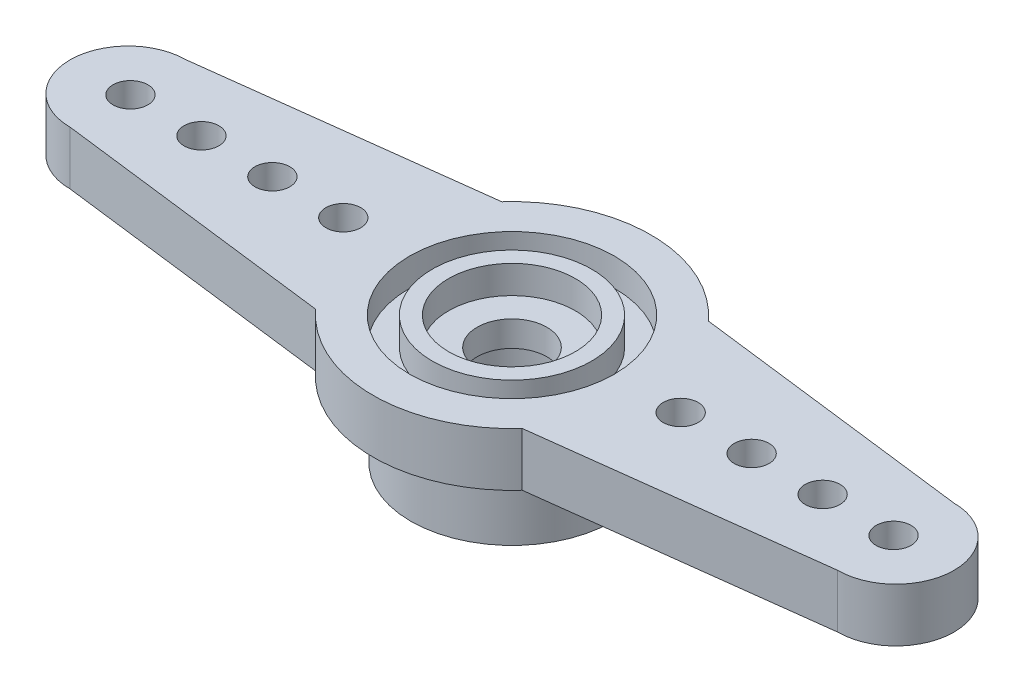
from build123d import *

# Parameters (mm, degrees)
SKETCH_1_R          = 1.5
SKETCH_1_R_2        = 0.75
EXTRUDE_1_DEPTH     = 2.3
SKETCH_2_R          = 4.35
SKETCH_2_R_2        = 2.45
EXTRUDE_2_DEPTH     = 3.2
CUT_EXTRUDE_START   = -1.2
SKETCH_3_R          = 4.4
SKETCH_3_R_2        = 3.425
SKETCH_3_R_3        = 2.725
SKETCH_3_R_4        = 1.5
CUT_EXTRUDE_1_DEPTH = 1.2


with BuildPart() as part:
    # Sketch 1 → Бобышка-Вытянуть1 (new body)
    with BuildSketch(Plane(origin=(0, 0, 0), x_dir=(1, 0, 0), z_dir=(0, 1, 0))):
        with BuildLine():
            Line((4.438538611, 4), (16.5, 2.5))
            ThreePointArc((16.5, 2.5), (19, 0), (16.5, -2.5))
            Line((16.5, -2.5), (4.438538611, -4))
            ThreePointArc((4.438538611, -4), (0, -5.975), (-4.438538611, -4))
            Line((-4.438538611, -4), (-16.5, -2.5))
            ThreePointArc((-16.5, -2.5), (-19, 0), (-16.5, 2.5))
            Line((-16.5, 2.5), (-4.438538611, 4))
            ThreePointArc((-4.438538611, 4), (0, 5.975), (4.438538611, 4))
        make_face()
        with Locations(Location((0, 0, 0), (0, 0, 270))):
            Circle(SKETCH_1_R, mode=Mode.SUBTRACT)
        with Locations(Location((10.3, 0, 0), (0, 0, 270))):
            Circle(SKETCH_1_R_2, mode=Mode.SUBTRACT)
        with Locations(Location((13.35, 0, 0), (0, 0, 270))):
            Circle(SKETCH_1_R_2, mode=Mode.SUBTRACT)
        with Locations(Location((16.4, 0, 0), (0, 0, 270))):
            Circle(SKETCH_1_R_2, mode=Mode.SUBTRACT)
        with Locations(Location((-10.3, 0, 0), (0, 0, 270))):
            Circle(SKETCH_1_R_2, mode=Mode.SUBTRACT)
        with Locations(Location((-13.35, 0, 0), (0, 0, 270))):
            Circle(SKETCH_1_R_2, mode=Mode.SUBTRACT)
        with Locations(Location((-16.4, 0, 0), (0, 0, 270))):
            Circle(SKETCH_1_R_2, mode=Mode.SUBTRACT)
        with Locations(Location((7.25, 0, 0), (0, 0, 270))):
            Circle(SKETCH_1_R_2, mode=Mode.SUBTRACT)
        with Locations(Location((-7.25, 0, 0), (0, 0, 270))):
            Circle(SKETCH_1_R_2, mode=Mode.SUBTRACT)
    extrude(amount=EXTRUDE_1_DEPTH)

    # Эскиз2 → Бобышка-Вытянуть2 (add)
    with BuildSketch(Plane.XZ):
        with Locations(Location((0, 0, 0), (0, 0, 90))):
            Circle(SKETCH_2_R)
        with Locations(Location((0, 0, 0), (0, 0, 270))):
            Circle(SKETCH_2_R_2, mode=Mode.SUBTRACT)
    extrude(amount=EXTRUDE_2_DEPTH)

    # Эскиз3 → Вырез-Вытянуть1 (cut)
    # profile 1 of 2: a face of its own
    with BuildSketch(Plane(origin=(0, 2.3, 0), x_dir=(1, 0, 0), z_dir=(0, 1, 0)).offset(CUT_EXTRUDE_START)):
        with Locations(Location((0, 0, 0), (0, 0, 270))):
            Circle(SKETCH_3_R)
        with Locations(Location((0, 0, 0), (0, 0, 270))):
            Circle(SKETCH_3_R_2, mode=Mode.SUBTRACT)
    # profile 2 of 2: a face of its own
    with BuildSketch(Plane(origin=(0, 2.3, 0), x_dir=(1, 0, 0), z_dir=(0, 1, 0)).offset(CUT_EXTRUDE_START)):
        with Locations(Location((0, 0, 0), (0, 0, 270))):
            Circle(SKETCH_3_R_3)
        with Locations(Location((0, 0, 0), (0, 0, 270))):
            Circle(SKETCH_3_R_4, mode=Mode.SUBTRACT)
    extrude(amount=CUT_EXTRUDE_1_DEPTH, mode=Mode.SUBTRACT)


solid = part.part
